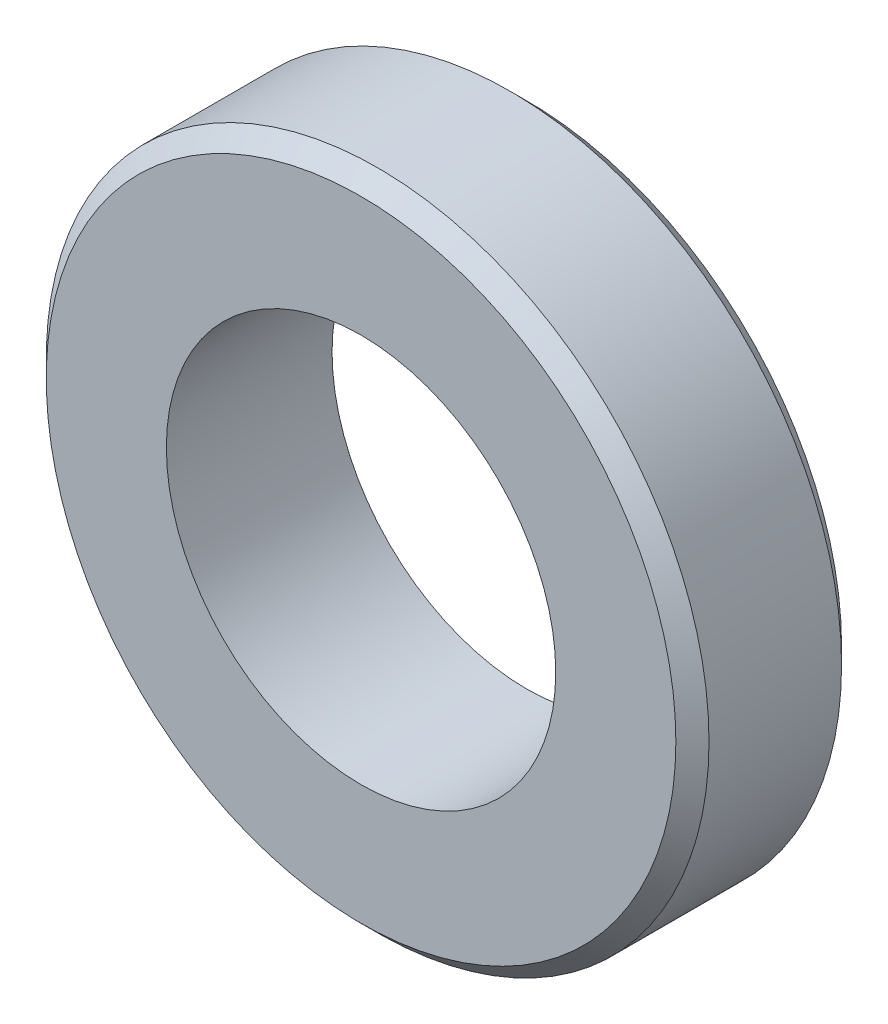
from build123d import *

# Parameters (mm, degrees)
SKETCH2_R           = 40
SKETCH2_R_2         = 23.5
BOSS_EXTRUDE1_DEPTH = 20
CHAMFER1_SIZE       = 2


with BuildPart() as part:
    # Sketch2 → Boss-Extrude1 (new body)
    with BuildSketch(Plane.XY):
        Circle(SKETCH2_R)
        Circle(SKETCH2_R_2, mode=Mode.SUBTRACT)
    extrude(amount=BOSS_EXTRUDE1_DEPTH)

    # Chamfer1
    chamfer1_edges = [part.edges().sort_by_distance(p)[0] for p in [
        (-40, 0, 0),
        (-40, 0, 20),
    ]]
    chamfer(chamfer1_edges, length=CHAMFER1_SIZE)


solid = part.part
